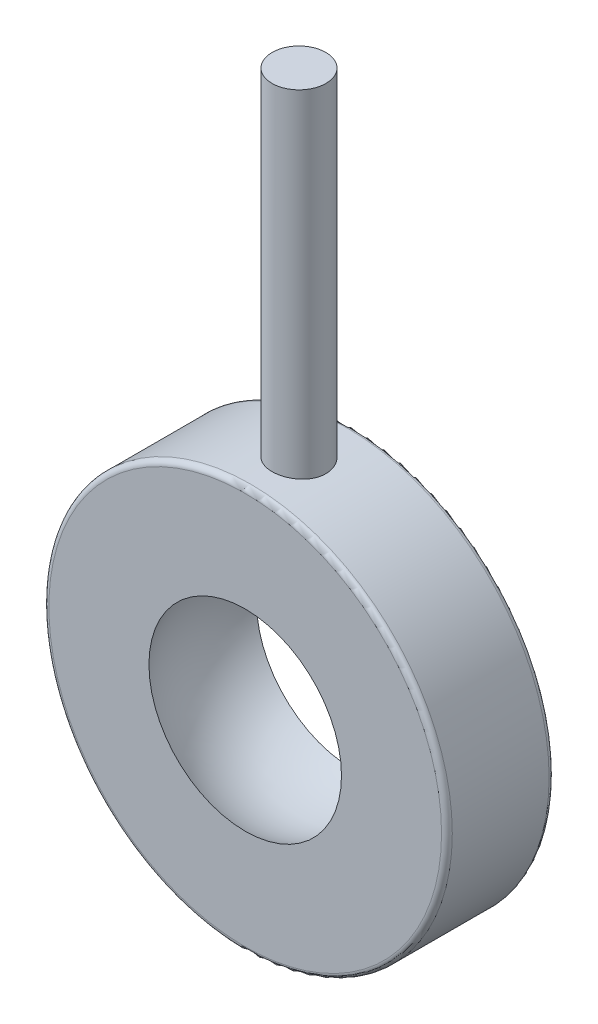
from build123d import *

# Parameters (mm, degrees)
SKETCH1_R           = 75
BOSS_EXTRUDE2_DEPTH = 20
SKETCH3_R           = 10
BOSS_EXTRUDE3_DEPTH = 200
FILLET1_R           = 2


with BuildPart() as part:
    # Sketch1 → Boss-Extrude2 (new, symmetric)
    with BuildSketch(Plane.XY):
        Circle(SKETCH1_R)
    extrude(amount=BOSS_EXTRUDE2_DEPTH, both=True)

    # Sketch3 → Boss-Extrude3 (add)
    with BuildSketch(Plane(origin=(0, 0, 0), x_dir=(1, 0, 0), z_dir=(0, 1, 0))):
        with Locations(Location((0, 0, 0), (0, 0, 90))):
            Circle(SKETCH3_R)
    extrude(amount=BOSS_EXTRUDE3_DEPTH)

    # Fillet1
    fillet1_edges = [part.edges().sort_by_distance(p)[0] for p in [
        (-75, 0, -20),
        (-75, 0, 20),
    ]]
    fillet(fillet1_edges, radius=FILLET1_R)

    # Sketch4 → Cut-Revolve1 (revolve, cut)
    with BuildSketch(Plane.XY):
        with BuildLine():
            Line((0, 41.005), (0, -41.005))
            ThreePointArc((0, -41.005), (-41.005, 0), (0, 41.005))
        make_face()
    revolve(axis=Axis((0, -93.529849824, 0), (0, 1, 0)), mode=Mode.SUBTRACT)


solid = part.part
